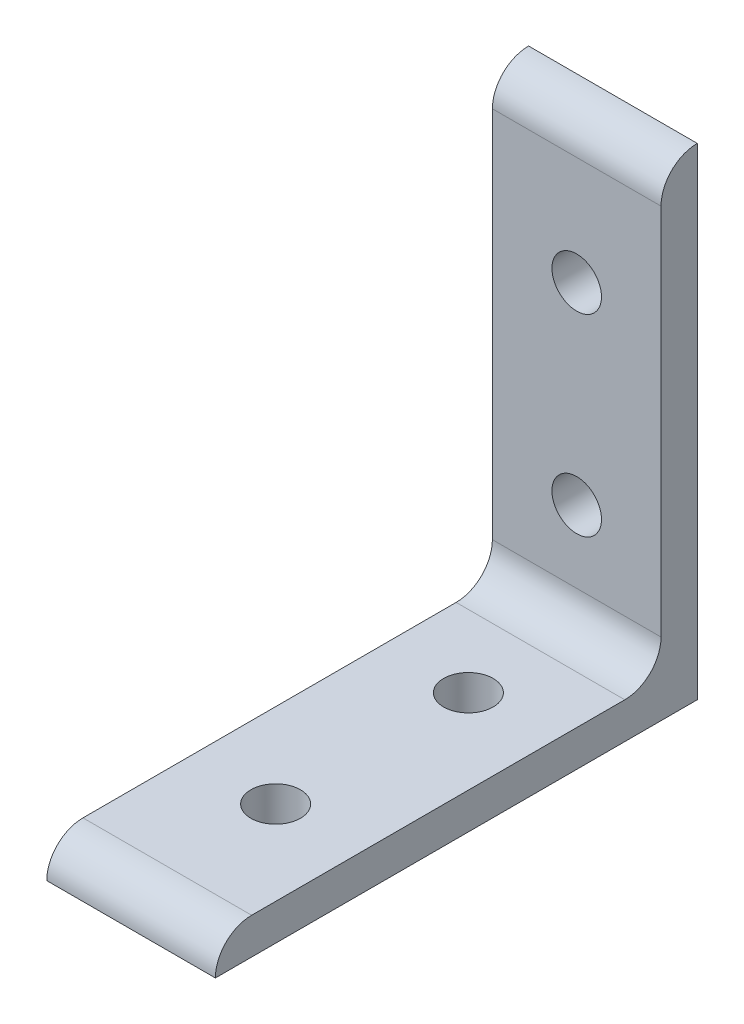
from build123d import *

# Parameters (mm, degrees)
BOSS_EXTRUDE1_DEPTH = 22.225
HOLE1_D             = 6.5278
HOLE1_DEPTH         = 63.5
HOLE2_D             = 6.5278
HOLE2_DEPTH         = 63.5
HOLE3_D             = 6.5278
HOLE3_DEPTH         = 63.5
HOLE4_D             = 6.5278
HOLE4_DEPTH         = 63.5
FILLET1_R           = 4.7752


with BuildPart() as part:
    # Sketch1 → Boss-Extrude1 (new body)
    with BuildSketch(Plane(origin=(22.225, 0, 0), x_dir=(0, 0, -1), z_dir=(1, 0, 0))):
        with BuildLine():
            Line((-39.52924138, -29.606090317), (23.97075862, -29.606090317))
            Line((23.97075862, -29.606090317), (23.97075862, 33.893909683))
            ThreePointArc((23.97075862, 33.893909683), (20.594182318, 32.495285985), (19.19555862, 29.118709683))
            Line((19.19555862, 29.118709683), (19.19555862, -24.830890317))
            Line((19.19555862, -24.830890317), (-34.75404138, -24.830890317))
            ThreePointArc((-34.75404138, -24.830890317), (-38.130617682, -26.229514015), (-39.52924138, -29.606090317))
        make_face()
    extrude(amount=-BOSS_EXTRUDE1_DEPTH)

    # Hole1
    with Locations(Plane(origin=(0, 0, -23.97075862), x_dir=(-1, 0, 0), z_dir=(0, 0, -1))):
        with Locations((-11.1125, -10.556090317)):
            Hole(HOLE1_D / 2, depth=HOLE1_DEPTH)

    # Hole2
    with Locations(Plane(origin=(0, 0, -23.97075862), x_dir=(-1, 0, 0), z_dir=(0, 0, -1))):
        with Locations((-11.1125, 14.843909683)):
            Hole(HOLE2_D / 2, depth=HOLE2_DEPTH)

    # Hole3
    with Locations(Plane.XZ.offset(29.606090317)):
        with Locations((11.1125, -4.92075862)):
            Hole(HOLE3_D / 2, depth=HOLE3_DEPTH)

    # Hole4
    with Locations(Plane.XZ.offset(29.606090317)):
        with Locations((11.1125, 20.47924138)):
            Hole(HOLE4_D / 2, depth=HOLE4_DEPTH)

    # Fillet1
    fillet1_edges = [part.edges().sort_by_distance(p)[0] for p in [
        (11.1125, -24.830890317, -19.19555862),
    ]]
    fillet(fillet1_edges, radius=FILLET1_R)


solid = part.part
